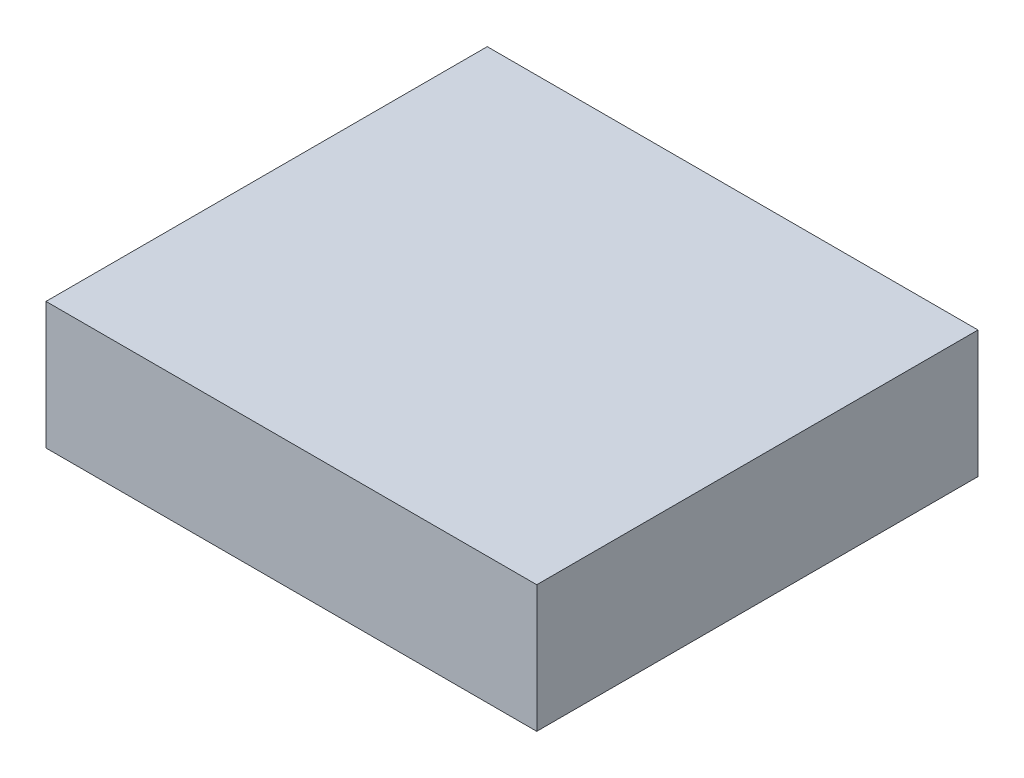
from build123d import *

# Parameters (mm, degrees)
SKETCH1_W           = 57.912
SKETCH1_H           = 52.07
BOSS_EXTRUDE1_DEPTH = 14.986


with BuildPart() as part:
    # Sketch1 → Boss-Extrude1 (new body)
    with BuildSketch(Plane(origin=(0, 0, 0), x_dir=(1, 0, 0), z_dir=(0, 1, 0))):
        with Locations((28.956, 26.035)):
            Rectangle(SKETCH1_W, SKETCH1_H)
    extrude(amount=BOSS_EXTRUDE1_DEPTH)


solid = part.part
